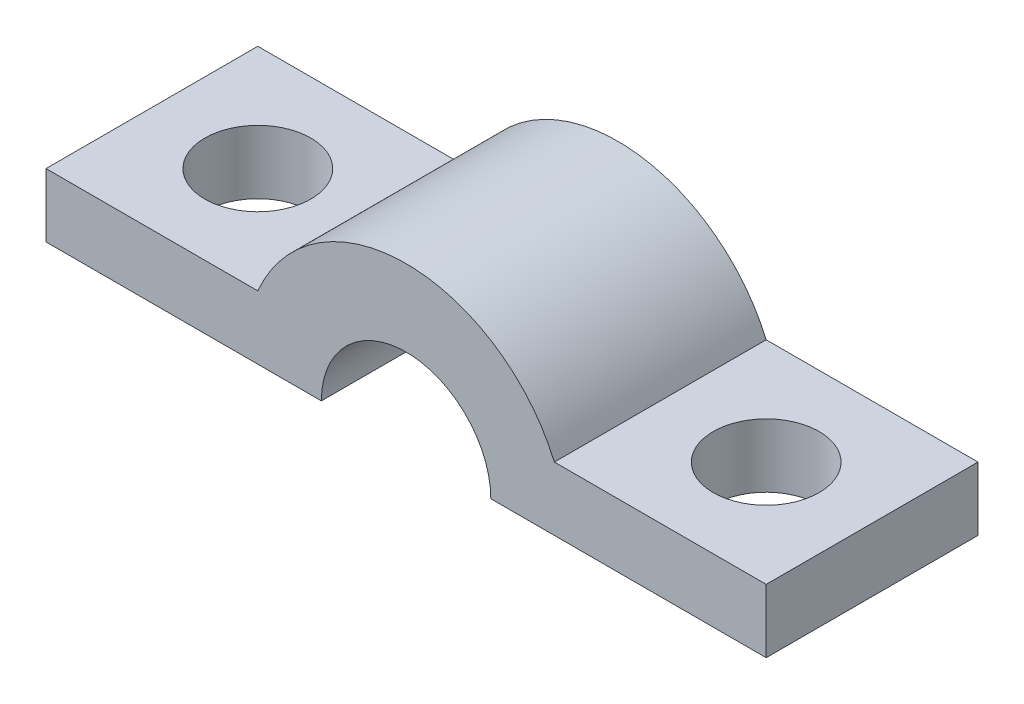
from build123d import *

# Parameters (mm, degrees)
BOSS_EXTRUDE1_DEPTH = 12.7
SKETCH2_R           = 3.175
CUT_EXTRUDE1_DEPTH  = 31.115483017


with BuildPart() as part:
    # Sketch1 → Boss-Extrude1 (new body)
    with BuildSketch(Plane.XY):
        with BuildLine():
            Line((-3.81, 3.81), (-16.51, 3.81))
            Line((-16.51, 3.81), (-16.51, 0))
            Line((-16.51, 0), (0, 0))
            ThreePointArc((0, 0), (5.08, 5.08), (10.16, 0))
            Line((10.16, 0), (26.67, 0))
            Line((26.67, 0), (26.67, 3.81))
            Line((26.67, 3.81), (13.97, 3.81))
            ThreePointArc((13.97, 3.81), (5.08, 9.672031844), (-3.81, 3.81))
        make_face()
    extrude(amount=BOSS_EXTRUDE1_DEPTH)

    # Sketch2 → Cut-Extrude1 (cut, through all)
    with BuildSketch(Plane(origin=(0, 3.81, 0), x_dir=(1, 0, 0), z_dir=(0, 1, 0))):
        with Locations(Location((-10.16, -6.35, 0), (0, 0, 180))):
            Circle(SKETCH2_R)
        with Locations((20.32, -6.35)):
            Circle(SKETCH2_R)
    extrude(amount=-CUT_EXTRUDE1_DEPTH, mode=Mode.SUBTRACT)


solid = part.part
